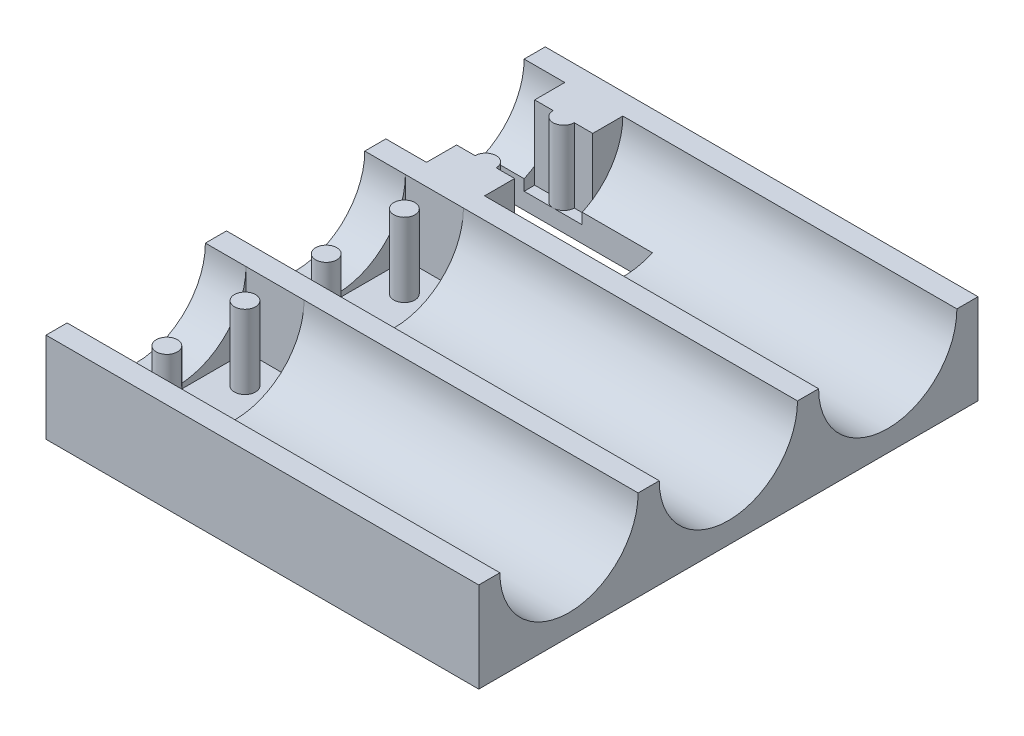
from build123d import *

# Parameters (mm, degrees)
BOSS_EXTRUDE1_DEPTH     = 41
BOSS_EXTRUDE2_REACH     = 50.098
SKETCH2_R               = 1
SKETCH4_W               = 5.5
SKETCH4_H               = 13.1
SKETCH4_R               = 1
CUT_EXTRUDE1_DEPTH      = 7
SKETCH5_R               = 2.25
BOSS_EXTRUDE3_DEPTH     = 2
BOSS_EXTRUDE4_REACH     = 59.938
SKETCH6_W               = 5.5
SKETCH6_H               = 2.85
CUT_EXTRUDE2_DEPTH      = 7
SKETCH8_W               = 69.342775087
SKETCH8_H               = 71.486609824
SKETCH8_W_2             = 41
SKETCH8_H_2             = 47.3
CUT_EXTRUDE3_DEPTH      = 58.676674836
CUT_EXTRUDE4_DEPTH      = 48.846865116
CUT_EXTRUDE4_DEPTH_BACK = 48.846865116
SKETCH9_W               = 16
SKETCH9_H               = 5.4


with BuildPart() as part:
    # Sketch1 → Boss-Extrude1 (new body)
    with BuildSketch(Plane(origin=(0, 0, 0), x_dir=(0, 0, -1), z_dir=(1, 0, 0))):
        with BuildLine():
            Line((-8.55, 0), (-6.55, 0))
            ThreePointArc((-6.55, 0), (0, -6.55), (6.55, 0))
            Line((6.55, 0), (8.55, 0))
            ThreePointArc((8.55, 0), (15.1, -6.55), (21.65, 0))
            Line((21.65, 0), (23.65, 0))
            Line((23.65, 0), (23.65, -8.55))
            Line((23.65, -8.55), (-23.65, -8.55))
            Line((-23.65, -8.55), (-23.65, 0))
            Line((-23.65, 0), (-21.65, 0))
            ThreePointArc((-21.65, 0), (-15.1, -6.55), (-8.55, 0))
        make_face()
    extrude(amount=BOSS_EXTRUDE1_DEPTH)

    # Sketch2 → Boss-Extrude2 (add, up to next)
    with BuildSketch(Plane(origin=(0, 0, 0), x_dir=(1, 0, 0), z_dir=(0, 1, 0)), mode=Mode.PRIVATE) as boss_extrude2_sk1:
        with Locations(Location((6.6, 3.7, 0), (0, 0, 270))):
            Circle(SKETCH2_R)
    boss_extrude2_tool1 = extrude(boss_extrude2_sk1.sketch, amount=-BOSS_EXTRUDE2_REACH, mode=Mode.PRIVATE) - part.part
    # Sketch2 → Boss-Extrude2 (add, up to next)
    with BuildSketch(Plane(origin=(0, 0, 0), x_dir=(1, 0, 0), z_dir=(0, 1, 0)), mode=Mode.PRIVATE) as boss_extrude2_sk2:
        with Locations(Location((6.6, -3.7, 0), (0, 0, 270))):
            Circle(SKETCH2_R)
    boss_extrude2_tool2 = extrude(boss_extrude2_sk2.sketch, amount=-BOSS_EXTRUDE2_REACH, mode=Mode.PRIVATE) - part.part
    # Sketch2 → Boss-Extrude2 (add, up to next)
    with BuildSketch(Plane(origin=(0, 0, 0), x_dir=(1, 0, 0), z_dir=(0, 1, 0)), mode=Mode.PRIVATE) as boss_extrude2_sk3:
        with Locations(Location((6.6, -11.4, 0), (0, 0, 270))):
            Circle(SKETCH2_R)
    boss_extrude2_tool3 = extrude(boss_extrude2_sk3.sketch, amount=-BOSS_EXTRUDE2_REACH, mode=Mode.PRIVATE) - part.part
    # Sketch2 → Boss-Extrude2 (add, up to next)
    with BuildSketch(Plane(origin=(0, 0, 0), x_dir=(1, 0, 0), z_dir=(0, 1, 0)), mode=Mode.PRIVATE) as boss_extrude2_sk4:
        with Locations(Location((6.6, -18.8, 0), (0, 0, 270))):
            Circle(SKETCH2_R)
    boss_extrude2_tool4 = extrude(boss_extrude2_sk4.sketch, amount=-BOSS_EXTRUDE2_REACH, mode=Mode.PRIVATE) - part.part
    # Sketch2 → Boss-Extrude2 (add, up to next)
    with BuildSketch(Plane(origin=(0, 0, 0), x_dir=(1, 0, 0), z_dir=(0, 1, 0)), mode=Mode.PRIVATE) as boss_extrude2_sk5:
        with Locations(Location((6.6, 18.8, 0), (0, 0, 270))):
            Circle(SKETCH2_R)
    boss_extrude2_tool5 = extrude(boss_extrude2_sk5.sketch, amount=-BOSS_EXTRUDE2_REACH, mode=Mode.PRIVATE) - part.part
    # Sketch2 → Boss-Extrude2 (add, up to next)
    with BuildSketch(Plane(origin=(0, 0, 0), x_dir=(1, 0, 0), z_dir=(0, 1, 0)), mode=Mode.PRIVATE) as boss_extrude2_sk6:
        with Locations(Location((6.6, 11.4, 0), (0, 0, 270))):
            Circle(SKETCH2_R)
    boss_extrude2_tool6 = extrude(boss_extrude2_sk6.sketch, amount=-BOSS_EXTRUDE2_REACH, mode=Mode.PRIVATE) - part.part
    add(boss_extrude2_tool1.solids().sort_by_distance((6.6, 0, -3.7))[0])
    add(boss_extrude2_tool2.solids().sort_by_distance((6.6, 0, 3.7))[0])
    add(boss_extrude2_tool3.solids().sort_by_distance((6.6, 0, 11.4))[0])
    add(boss_extrude2_tool4.solids().sort_by_distance((6.6, 0, 18.8))[0])
    add(boss_extrude2_tool5.solids().sort_by_distance((6.6, 0, -18.8))[0])
    add(boss_extrude2_tool6.solids().sort_by_distance((6.6, 0, -11.4))[0])

    # Sketch4 → Cut-Extrude1 (cut)
    # profile 1 of 3: a face of its own
    with BuildSketch(Plane(origin=(0, 0, 0), x_dir=(1, 0, 0), z_dir=(0, 1, 0))):
        with Locations((6.6, 0)):
            Rectangle(SKETCH4_W, SKETCH4_H)
        with Locations(Location((6.6, 3.7, 0), (0, 0, 270))):
            Circle(SKETCH4_R, mode=Mode.SUBTRACT)
        with Locations(Location((6.6, -3.7, 0), (0, 0, 270))):
            Circle(SKETCH4_R, mode=Mode.SUBTRACT)
    # profile 2 of 3: a face of its own
    with BuildSketch(Plane(origin=(0, 0, 0), x_dir=(1, 0, 0), z_dir=(0, 1, 0))):
        with Locations((6.6, -15.1)):
            Rectangle(SKETCH4_W, SKETCH4_H)
        with Locations(Location((6.6, -11.4, 0), (0, 0, 90))):
            Circle(SKETCH4_R, mode=Mode.SUBTRACT)
        with Locations(Location((6.6, -18.8, 0), (0, 0, 90))):
            Circle(SKETCH4_R, mode=Mode.SUBTRACT)
    # profile 3 of 3: a face of its own
    with BuildSketch(Plane(origin=(0, 0, 0), x_dir=(1, 0, 0), z_dir=(0, 1, 0))):
        with Locations((6.6, 15.1)):
            Rectangle(SKETCH4_W, SKETCH4_H)
        with Locations(Location((6.6, 11.4, 0), (0, 0, 90))):
            Circle(SKETCH4_R, mode=Mode.SUBTRACT)
        with Locations(Location((6.6, 18.8, 0), (0, 0, 90))):
            Circle(SKETCH4_R, mode=Mode.SUBTRACT)
    extrude(amount=-CUT_EXTRUDE1_DEPTH, mode=Mode.SUBTRACT)

    # Sketch5 → Boss-Extrude3 (add)
    # profile 1 of 4: a face of its own
    with BuildSketch(Plane.XZ.offset(8.55)):
        with BuildLine():
            Line((0, 23.65), (0, 20.65))
            Line((0, 20.65), (-5.25520382, 20.65))
            ThreePointArc((-5.25520382, 20.65), (-6.669417382, 21.235786438), (-7.25520382, 22.65))
            Line((-7.25520382, 22.65), (-7.25520382, 28.90520382))
            ThreePointArc((-7.25520382, 28.90520382), (-6.669417382, 30.319417382), (-5.25520382, 30.90520382))
            Line((-5.25520382, 30.90520382), (1, 30.90520382))
            ThreePointArc((1, 30.90520382), (2.414213562, 30.319417382), (3, 28.90520382))
            Line((3, 28.90520382), (3, 23.65))
            Line((3, 23.65), (0, 23.65))
        make_face()
        with Locations(Location((-3.00520382, 26.65520382, 0), (0, 0, 270))):
            Circle(SKETCH5_R, mode=Mode.SUBTRACT)
    # profile 2 of 4: a face of its own
    with BuildSketch(Plane.XZ.offset(8.55)):
        with BuildLine():
            Line((0, -23.65), (3, -23.65))
            Line((3, -23.65), (3, -28.90520382))
            ThreePointArc((3, -28.90520382), (2.414213562, -30.319417382), (1, -30.90520382))
            Line((1, -30.90520382), (-5.25520382, -30.90520382))
            ThreePointArc((-5.25520382, -30.90520382), (-6.669417382, -30.319417382), (-7.25520382, -28.90520382))
            Line((-7.25520382, -28.90520382), (-7.25520382, -22.65))
            ThreePointArc((-7.25520382, -22.65), (-6.669417382, -21.235786438), (-5.25520382, -20.65))
            Line((-5.25520382, -20.65), (0, -20.65))
            Line((0, -20.65), (0, -23.65))
        make_face()
        with Locations(Location((-3.00520382, -26.65520382, 0), (0, 0, 90))):
            Circle(SKETCH5_R, mode=Mode.SUBTRACT)
    # profile 3 of 4: a face of its own
    with BuildSketch(Plane.XZ.offset(8.55)):
        with BuildLine():
            Line((41, -23.65), (41, -20.65))
            Line((41, -20.65), (46.25520382, -20.65))
            ThreePointArc((46.25520382, -20.65), (47.669417382, -21.235786438), (48.25520382, -22.65))
            Line((48.25520382, -22.65), (48.25520382, -28.90520382))
            ThreePointArc((48.25520382, -28.90520382), (47.669417382, -30.319417382), (46.25520382, -30.90520382))
            Line((46.25520382, -30.90520382), (40, -30.90520382))
            ThreePointArc((40, -30.90520382), (38.585786438, -30.319417382), (38, -28.90520382))
            Line((38, -28.90520382), (38, -23.65))
            Line((38, -23.65), (41, -23.65))
        make_face()
        with Locations(Location((44.00520382, -26.65520382, 0), (0, 0, 270))):
            Circle(SKETCH5_R, mode=Mode.SUBTRACT)
    # profile 4 of 4: a face of its own
    with BuildSketch(Plane.XZ.offset(8.55)):
        with BuildLine():
            Line((41, 23.65), (38, 23.65))
            Line((38, 23.65), (38, 28.90520382))
            ThreePointArc((38, 28.90520382), (38.585786438, 30.319417382), (40, 30.90520382))
            Line((40, 30.90520382), (46.25520382, 30.90520382))
            ThreePointArc((46.25520382, 30.90520382), (47.669417382, 30.319417382), (48.25520382, 28.90520382))
            Line((48.25520382, 28.90520382), (48.25520382, 22.65))
            ThreePointArc((48.25520382, 22.65), (47.669417382, 21.235786438), (46.25520382, 20.65))
            Line((46.25520382, 20.65), (41, 20.65))
            Line((41, 20.65), (41, 23.65))
        make_face()
        with Locations(Location((44.00520382, 26.65520382, 0), (0, 0, 90))):
            Circle(SKETCH5_R, mode=Mode.SUBTRACT)
    extrude(amount=-BOSS_EXTRUDE3_DEPTH)

    # Boss-Extrude4: up to this face of the body (flat: up to its plane)
    boss_extrude4_end = Plane(part.part.faces().sort_by_distance((6.6, -7, -15.1))[0])
    # Sketch6 → Boss-Extrude4 (add, up to the picked face)
    with BuildSketch(Plane(origin=(0, 0, 0), x_dir=(1, 0, 0), z_dir=(0, 1, 0)), mode=Mode.PRIVATE) as boss_extrude4_sk1:
        with Locations((6.6, -5.125)):
            Rectangle(SKETCH6_W, SKETCH6_H)
    boss_extrude4_tool1 = split(extrude(boss_extrude4_sk1.sketch, amount=-BOSS_EXTRUDE4_REACH, mode=Mode.PRIVATE), bisect_by=boss_extrude4_end, keep=Keep.BOTH, mode=Mode.PRIVATE)
    # Sketch6 → Boss-Extrude4 (add, up to the picked face)
    with BuildSketch(Plane(origin=(0, 0, 0), x_dir=(1, 0, 0), z_dir=(0, 1, 0)), mode=Mode.PRIVATE) as boss_extrude4_sk2:
        with Locations((6.6, 5.125)):
            Rectangle(SKETCH6_W, SKETCH6_H)
    boss_extrude4_tool2 = split(extrude(boss_extrude4_sk2.sketch, amount=-BOSS_EXTRUDE4_REACH, mode=Mode.PRIVATE), bisect_by=boss_extrude4_end, keep=Keep.BOTH, mode=Mode.PRIVATE)
    # Sketch6 → Boss-Extrude4 (add, up to the picked face)
    with BuildSketch(Plane(origin=(0, 0, 0), x_dir=(1, 0, 0), z_dir=(0, 1, 0)), mode=Mode.PRIVATE) as boss_extrude4_sk3:
        with Locations((6.6, -20.225)):
            Rectangle(SKETCH6_W, SKETCH6_H)
    boss_extrude4_tool3 = split(extrude(boss_extrude4_sk3.sketch, amount=-BOSS_EXTRUDE4_REACH, mode=Mode.PRIVATE), bisect_by=boss_extrude4_end, keep=Keep.BOTH, mode=Mode.PRIVATE)
    # Sketch6 → Boss-Extrude4 (add, up to the picked face)
    with BuildSketch(Plane(origin=(0, 0, 0), x_dir=(1, 0, 0), z_dir=(0, 1, 0)), mode=Mode.PRIVATE) as boss_extrude4_sk4:
        with Locations((6.6, -9.975)):
            Rectangle(SKETCH6_W, SKETCH6_H)
    boss_extrude4_tool4 = split(extrude(boss_extrude4_sk4.sketch, amount=-BOSS_EXTRUDE4_REACH, mode=Mode.PRIVATE), bisect_by=boss_extrude4_end, keep=Keep.BOTH, mode=Mode.PRIVATE)
    # Sketch6 → Boss-Extrude4 (add, up to the picked face)
    with BuildSketch(Plane(origin=(0, 0, 0), x_dir=(1, 0, 0), z_dir=(0, 1, 0)), mode=Mode.PRIVATE) as boss_extrude4_sk5:
        with Locations((6.6, 9.975)):
            Rectangle(SKETCH6_W, SKETCH6_H)
    boss_extrude4_tool5 = split(extrude(boss_extrude4_sk5.sketch, amount=-BOSS_EXTRUDE4_REACH, mode=Mode.PRIVATE), bisect_by=boss_extrude4_end, keep=Keep.BOTH, mode=Mode.PRIVATE)
    # Sketch6 → Boss-Extrude4 (add, up to the picked face)
    with BuildSketch(Plane(origin=(0, 0, 0), x_dir=(1, 0, 0), z_dir=(0, 1, 0)), mode=Mode.PRIVATE) as boss_extrude4_sk6:
        with Locations((6.6, 20.225)):
            Rectangle(SKETCH6_W, SKETCH6_H)
    boss_extrude4_tool6 = split(extrude(boss_extrude4_sk6.sketch, amount=-BOSS_EXTRUDE4_REACH, mode=Mode.PRIVATE), bisect_by=boss_extrude4_end, keep=Keep.BOTH, mode=Mode.PRIVATE)
    add(boss_extrude4_tool1.solids().sort_by(Axis((6.6, 0, 5.125), (0, -1, 0)))[0])
    add(boss_extrude4_tool2.solids().sort_by(Axis((6.6, 0, -5.125), (0, -1, 0)))[0])
    add(boss_extrude4_tool3.solids().sort_by(Axis((6.6, 0, 20.225), (0, -1, 0)))[0])
    add(boss_extrude4_tool4.solids().sort_by(Axis((6.6, 0, 9.975), (0, -1, 0)))[0])
    add(boss_extrude4_tool5.solids().sort_by(Axis((6.6, 0, -9.975), (0, -1, 0)))[0])
    add(boss_extrude4_tool6.solids().sort_by(Axis((6.6, 0, -20.225), (0, -1, 0)))[0])

    # Sketch7 → Cut-Extrude2 (cut)
    with BuildSketch(Plane(origin=(0, 0, 0), x_dir=(1, 0, 0), z_dir=(0, 1, 0))):
        with BuildLine():
            Line((5.6, 3.7), (3.85, 3.7))
            Line((3.85, 3.7), (3.85, 6.55))
            Line((3.85, 6.55), (9.35, 6.55))
            Line((9.35, 6.55), (9.35, 3.7))
            Line((9.35, 3.7), (7.6, 3.7))
            ThreePointArc((7.6, 3.7), (6.6, 4.7), (5.6, 3.7))
        make_face()
        with BuildLine():
            Line((7.6, -3.7), (9.35, -3.7))
            Line((9.35, -3.7), (9.35, -6.55))
            Line((9.35, -6.55), (3.85, -6.55))
            Line((3.85, -6.55), (3.85, -3.7))
            Line((3.85, -3.7), (5.6, -3.7))
            ThreePointArc((5.6, -3.7), (6.6, -4.7), (7.6, -3.7))
        make_face()
        with BuildLine():
            Line((5.6, -11.4), (3.85, -11.4))
            Line((3.85, -11.4), (3.85, -8.55))
            Line((3.85, -8.55), (9.35, -8.55))
            Line((9.35, -8.55), (9.35, -11.4))
            Line((9.35, -11.4), (7.6, -11.4))
            ThreePointArc((7.6, -11.4), (6.6, -10.4), (5.6, -11.4))
        make_face()
        with BuildLine():
            Line((7.6, -18.8), (9.35, -18.8))
            Line((9.35, -18.8), (9.35, -21.65))
            Line((9.35, -21.65), (3.85, -21.65))
            Line((3.85, -21.65), (3.85, -18.8))
            Line((3.85, -18.8), (5.6, -18.8))
            ThreePointArc((5.6, -18.8), (6.6, -19.8), (7.6, -18.8))
        make_face()
    extrude(amount=-CUT_EXTRUDE2_DEPTH, mode=Mode.SUBTRACT)

    # Sketch8 → Cut-Extrude3 (cut, through all)
    with BuildSketch(Plane(origin=(0, -6.55, 0), x_dir=(1, 0, 0), z_dir=(0, 1, 0))):
        with Locations((17.956765915, 2.528550286)):
            Rectangle(SKETCH8_W, SKETCH8_H)
        with Locations((20.5, 0)):
            Rectangle(SKETCH8_W_2, SKETCH8_H_2, mode=Mode.SUBTRACT)
    extrude(amount=-CUT_EXTRUDE3_DEPTH, mode=Mode.SUBTRACT)

    # Sketch9 → Cut-Extrude4 (cut, two sides: drawn at the far end of the back side and taken through both)
    with BuildSketch(Plane(origin=(0, -7, 0), x_dir=(1, 0, 0), z_dir=(0, 1, 0)).offset(-CUT_EXTRUDE4_DEPTH_BACK)):
        with Locations((8, 15.1)):
            Rectangle(SKETCH9_W, SKETCH9_H)
    extrude(amount=CUT_EXTRUDE4_DEPTH + CUT_EXTRUDE4_DEPTH_BACK, mode=Mode.SUBTRACT)


solid = part.part
